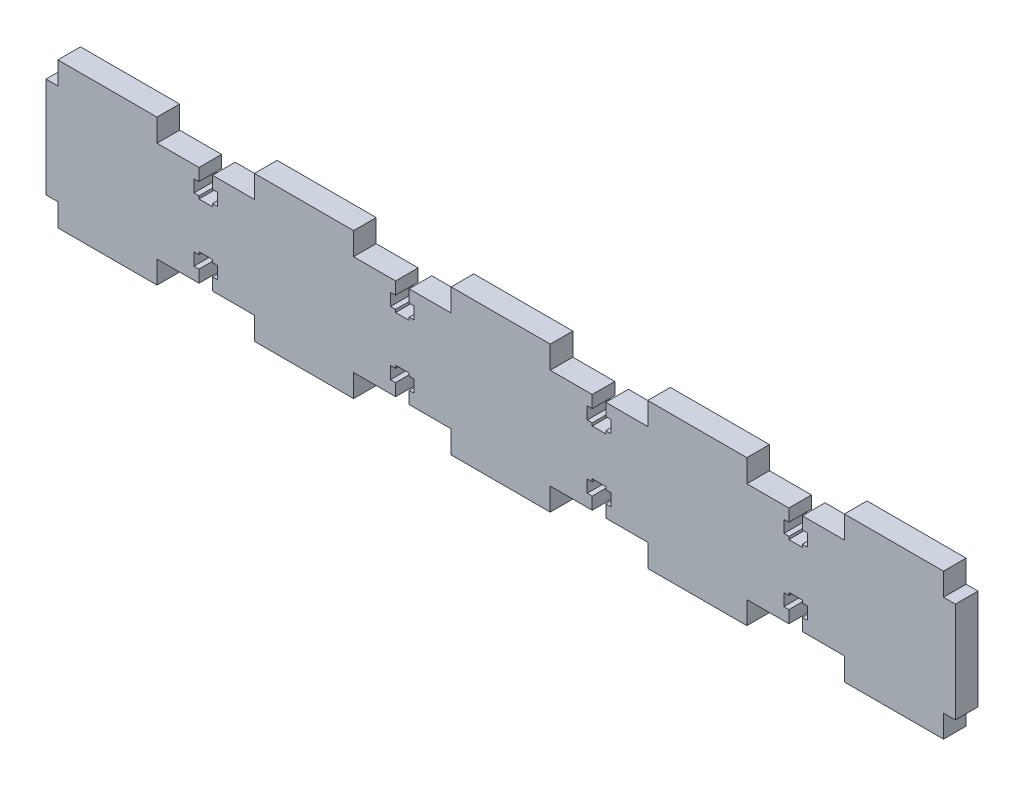
from build123d import *

# Parameters (mm, degrees)
BOSS_EXTRUDE1_DEPTH = 5.842


with BuildPart() as part:
    # Sketch1 → Boss-Extrude1 (new body)
    with BuildSketch(Plane.XY):
        Polygon((-38, 18.796), (-63.6, 18.796), (-63.6, 12.954), (-74.4474, 12.954), (-74.4474, 9.779), (-73.152, 9.779), (-73.152, 6.604), (-74.4474, 6.604), (-74.4474, 5.896), (-77.9526, 5.896), (-77.9526, 6.604), (-79.248, 6.604), (-79.248, 9.779), (-77.9526, 9.779), (-77.9526, 12.954), (-88.8, 12.954), (-88.8, 18.796), (-114.4, 18.796), (-114.4, 12.954), (-117.475, 12.954), (-117.475, -12.954), (-114.4, -12.954), (-114.4, -18.796), (-88.8, -18.796), (-88.8, -12.954), (-77.9526, -12.954), (-77.9526, -9.779), (-79.248, -9.779), (-79.248, -6.604), (-77.9526, -6.604), (-77.9526, -5.896), (-74.4474, -5.896), (-74.4474, -6.604), (-73.152, -6.604), (-73.152, -9.779), (-74.4474, -9.779), (-74.4474, -12.954), (-63.6, -12.954), (-63.6, -18.796), (-38, -18.796), (-38, -12.954), (-27.1526, -12.954), (-27.1526, -9.779), (-28.448, -9.779), (-28.448, -6.604), (-27.1526, -6.604), (-27.1526, -5.896), (-23.6474, -5.896), (-23.6474, -6.604), (-22.352, -6.604), (-22.352, -9.779), (-23.6474, -9.779), (-23.6474, -12.954), (-12.8, -12.954), (-12.8, -18.796), (12.8, -18.796), (12.8, -12.954), (23.6474, -12.954), (23.6474, -9.779), (22.352, -9.779), (22.352, -6.604), (23.6474, -6.604), (23.6474, -5.896), (27.1526, -5.896), (27.1526, -6.604), (28.448, -6.604), (28.448, -9.779), (27.1526, -9.779), (27.1526, -12.954), (38, -12.954), (38, -18.796), (63.6, -18.796), (63.6, -12.954), (74.4474, -12.954), (74.4474, -9.779), (73.152, -9.779), (73.152, -6.604), (74.4474, -6.604), (74.4474, -5.896), (77.9526, -5.896), (77.9526, -6.604), (79.248, -6.604), (79.248, -9.779), (77.9526, -9.779), (77.9526, -12.954), (88.8, -12.954), (88.8, -18.796), (114.4, -18.796), (114.4, -12.954), (117.475, -12.954), (117.475, 12.954), (114.4, 12.954), (114.4, 18.796), (88.8, 18.796), (88.8, 12.954), (77.9526, 12.954), (77.9526, 9.779), (79.248, 9.779), (79.248, 6.604), (77.9526, 6.604), (77.9526, 5.896), (74.4474, 5.896), (74.4474, 6.604), (73.152, 6.604), (73.152, 9.779), (74.4474, 9.779), (74.4474, 12.954), (63.6, 12.954), (63.6, 18.796), (38, 18.796), (38, 12.954), (27.1526, 12.954), (27.1526, 9.779), (28.448, 9.779), (28.448, 6.604), (27.1526, 6.604), (27.1526, 5.896), (23.6474, 5.896), (23.6474, 6.604), (22.352, 6.604), (22.352, 9.779), (23.6474, 9.779), (23.6474, 12.954), (12.8, 12.954), (12.8, 18.796), (-12.8, 18.796), (-12.8, 12.954), (-23.6474, 12.954), (-23.6474, 9.779), (-22.352, 9.779), (-22.352, 6.604), (-23.6474, 6.604), (-23.6474, 5.896), (-27.1526, 5.896), (-27.1526, 6.604), (-28.448, 6.604), (-28.448, 9.779), (-27.1526, 9.779), (-27.1526, 12.954), (-38, 12.954), align=None)
    extrude(amount=BOSS_EXTRUDE1_DEPTH)


solid = part.part
